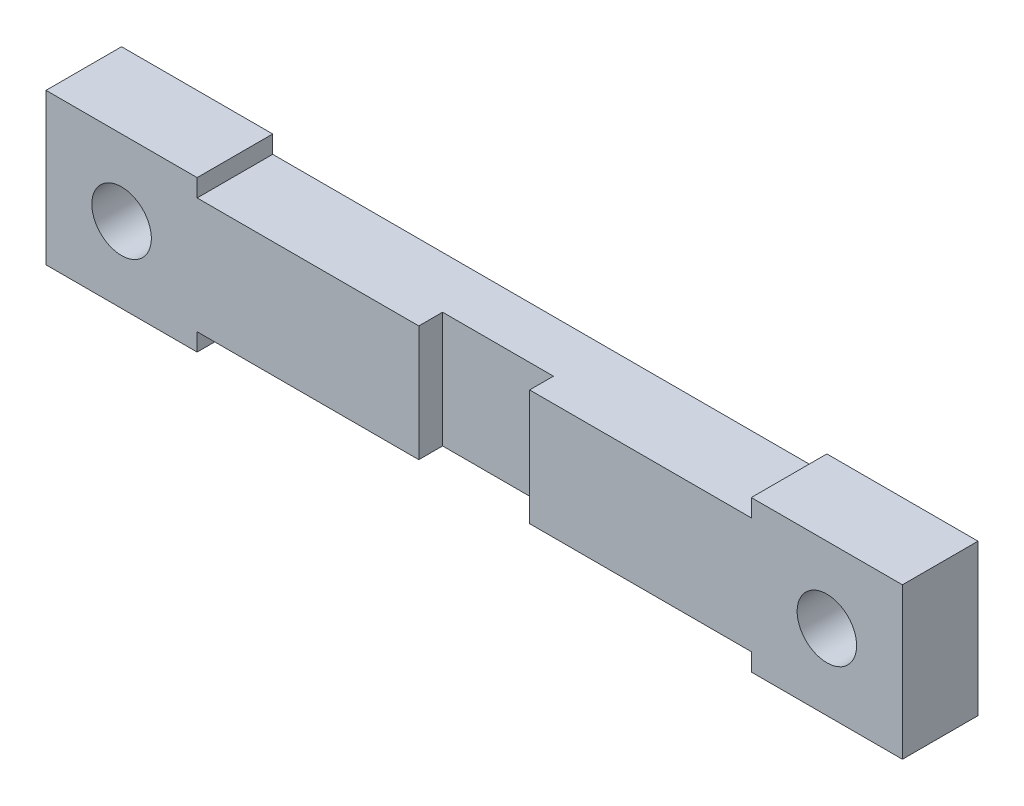
from build123d import *

# Parameters (mm, degrees)
SKETCH1_R           = 1.5
SKETCH1_W           = 27.94
SKETCH1_H           = 5.842
BOSS_EXTRUDE1_DEPTH = 3.81
SKETCH2_W           = 5.588
SKETCH2_H           = 5.842
CUT_EXTRUDE1_DEPTH  = 1.2


with BuildPart() as part:
    # Sketch1 → Boss-Extrude1 (new body)
    # profile 1 of 3: a face of its own
    with BuildSketch(Plane.XY):
        Polygon((-13.97, -3.81), (-13.97, -2.921), (-13.97, 2.921), (-13.97, 3.81), (-21.59, 3.81), (-21.59, -3.81), align=None)
        with Locations(Location((-17.78, 0, 0), (0, 0, 180))):
            Circle(SKETCH1_R, mode=Mode.SUBTRACT)
    # profile 2 of 3: a face of its own
    with BuildSketch(Plane.XY):
        Rectangle(SKETCH1_W, SKETCH1_H)
    # profile 3 of 3: a face of its own
    with BuildSketch(Plane.XY):
        Polygon((13.97, 2.921), (13.97, -2.921), (13.97, -3.81), (21.59, -3.81), (21.59, 3.81), (13.97, 3.81), align=None)
        with Locations(Location((17.78, 0, 0), (0, 0, 180))):
            Circle(SKETCH1_R, mode=Mode.SUBTRACT)
    extrude(amount=BOSS_EXTRUDE1_DEPTH)

    # Sketch2 → Cut-Extrude1 (cut)
    with BuildSketch(Plane.XY.offset(3.81)):
        Rectangle(SKETCH2_W, SKETCH2_H)
    extrude(amount=-CUT_EXTRUDE1_DEPTH, mode=Mode.SUBTRACT)


solid = part.part
